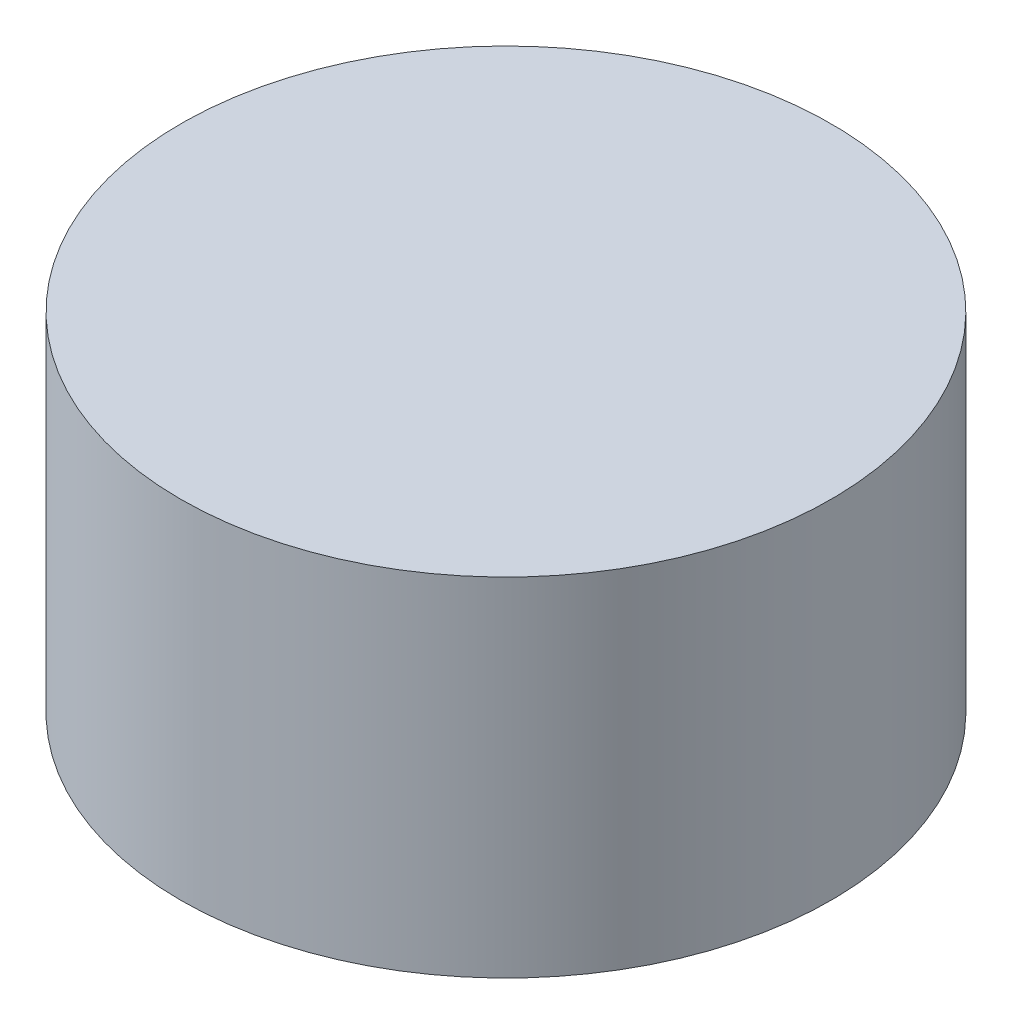
from build123d import *

# Parameters (mm, degrees)
SKETCH1_R           = 11.0363
BOSS_EXTRUDE1_DEPTH = 5.8928


with BuildPart() as part:
    # Sketch1 → Boss-Extrude1 (new, symmetric)
    with BuildSketch(Plane(origin=(0, 0, 0), x_dir=(1, 0, 0), z_dir=(0, 1, 0))):
        with Locations(Location((0, 0, 0), (0, 0, 270))):
            Circle(SKETCH1_R)
    extrude(amount=BOSS_EXTRUDE1_DEPTH, both=True)


solid = part.part
